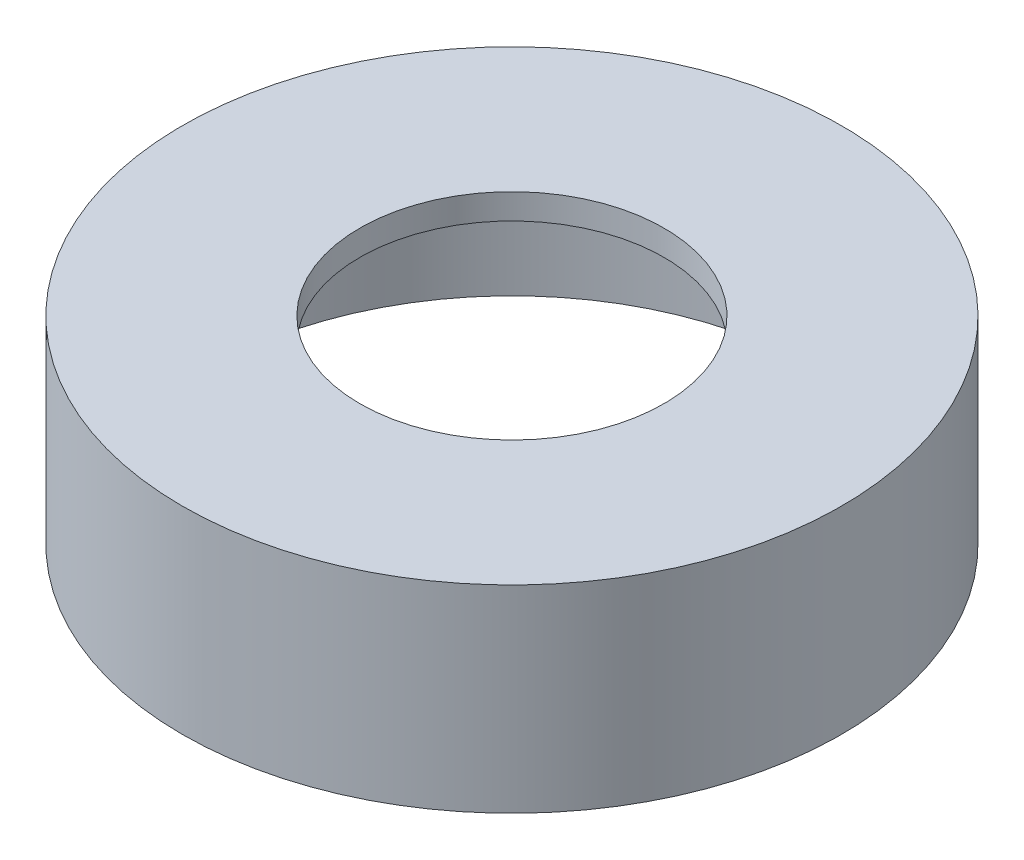
from build123d import *

# Parameters (mm, degrees)
CROQUIS1_R              = 32.5
SALIENTE_EXTRUIR1_DEPTH = 19.5
VACIADO1_T              = -2.5
CROQUIS2_R              = 15
CORTAR_EXTRUIR1_DEPTH   = 19.5
SALIENTE_EXTRUIR2_DEPTH = 1.5
MATRIZC2_COUNT          = 4


with BuildPart() as part:
    # Croquis1 → Saliente-Extruir1 (new body)
    with BuildSketch(Plane(origin=(0, 0, 0), x_dir=(1, 0, 0), z_dir=(0, 1, 0))):
        with Locations(Location((0, 0, 0), (0, 0, 270))):
            Circle(CROQUIS1_R)
    extrude(amount=SALIENTE_EXTRUIR1_DEPTH)

    # Vaciado1
    vaciado1_openings = [part.faces().sort_by_distance(p)[0] for p in [
        (0, 0, 0),
    ]]
    offset(amount=VACIADO1_T, openings=vaciado1_openings, kind=Kind.INTERSECTION)

    # Croquis2 → Cortar-Extruir1 (cut)
    with BuildSketch(Plane(origin=(0, 19.5, 0), x_dir=(1, 0, 0), z_dir=(0, 1, 0))):
        with Locations(Location((0, 0, 0), (0, 0, 270))):
            Circle(CROQUIS2_R)
    extrude(amount=-CORTAR_EXTRUIR1_DEPTH, mode=Mode.SUBTRACT)

    # Croquis3 → Saliente-Extruir2 (add, symmetric)
    with BuildSketch(Plane(origin=(0, 0, 0), x_dir=(0, 0, -1), z_dir=(1, 0, 0))):
        Polygon((-30, 4), (-28.1, 4), (-28.1, 6), (-30, 8), align=None)
    saliente_extruir2 = extrude(amount=SALIENTE_EXTRUIR2_DEPTH, both=True)

    # MatrizC2: Saliente-Extruir2 ×4 about axis
    matrizc2_axis = Axis((0, 0, 0), (0, 1, 0))
    for i in range(1, MATRIZC2_COUNT):
        add(saliente_extruir2.rotate(matrizc2_axis, i * 360 / MATRIZC2_COUNT))


solid = part.part
